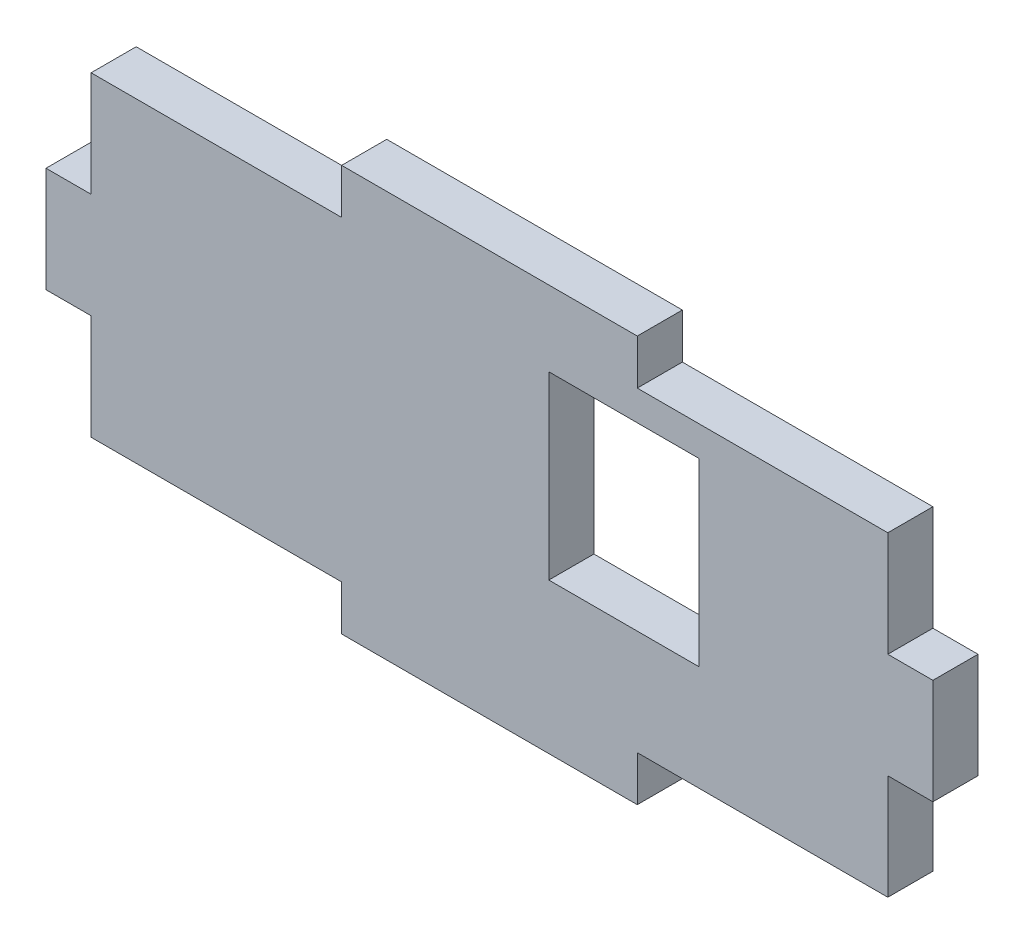
from build123d import *

# Parameters (mm, degrees)
SKETCH1_W           = 10
SKETCH1_H           = 12
BOSS_EXTRUDE1_DEPTH = 3


with BuildPart() as part:
    # Sketch1 → Boss-Extrude1 (new body)
    with BuildSketch(Plane.XY):
        Polygon((-26.5, 10.5), (-26.5, 3.5), (-29.5, 3.5), (-29.5, -3.5), (-26.5, -3.5), (-26.5, -10.5), (-9.833333333, -10.5), (-9.833333333, -13.5), (9.833333333, -13.5), (9.833333333, -10.5), (26.5, -10.5), (26.5, -3.5), (29.5, -3.5), (29.5, 3.5), (26.5, 3.5), (26.5, 10.5), (9.833333333, 10.5), (9.833333333, 13.5), (-9.833333333, 13.5), (-9.833333333, 10.5), align=None)
        with Locations((8.95, 2.5)):
            Rectangle(SKETCH1_W, SKETCH1_H, mode=Mode.SUBTRACT)
    extrude(amount=BOSS_EXTRUDE1_DEPTH)


solid = part.part
